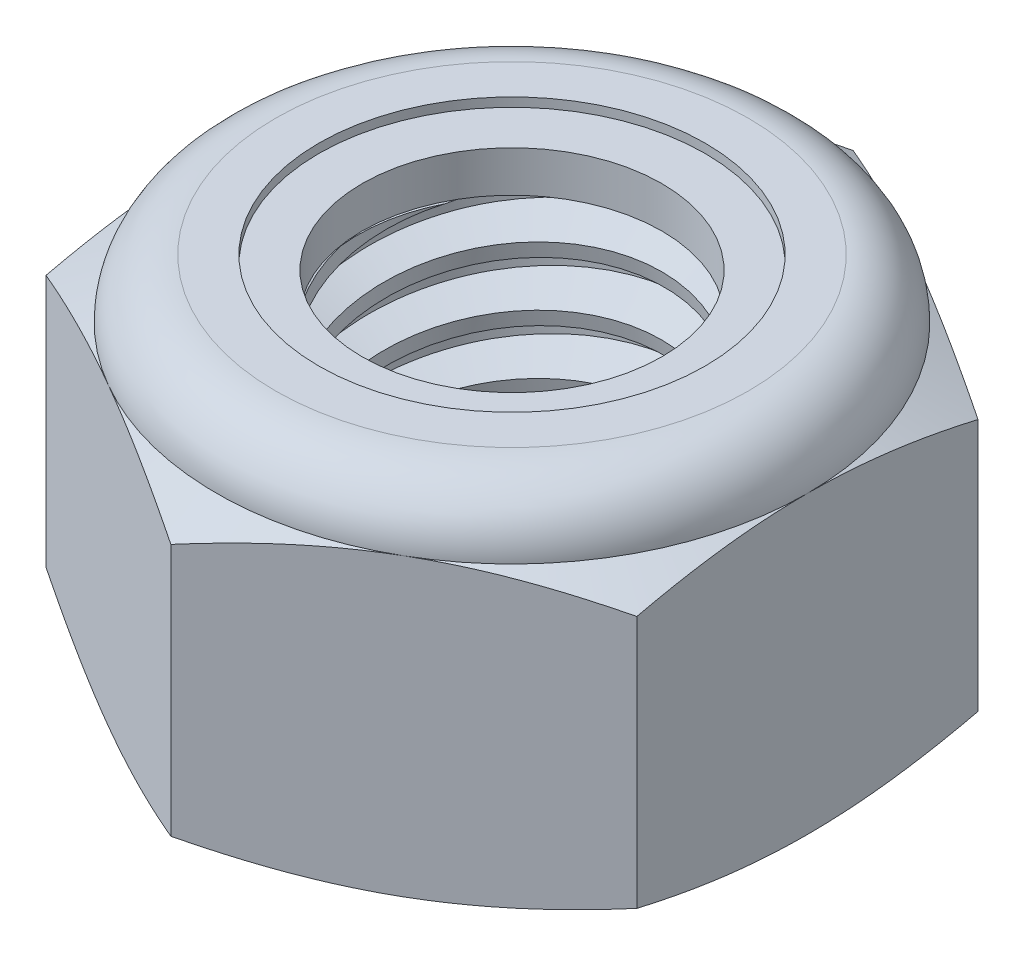
from build123d import *

# Parameters (mm, degrees)
EXTRUDE1_DEPTH      = 6
SKETCH2_W           = 3
SKETCH2_H           = 6
LPATTERN1_COUNT     = 6
LPATTERN1_PITCH     = 1
LPATTERN1_COL_COUNT = 2
LPATTERN1_COL_PITCH = 1


with BuildPart() as part:
    # Sketch1 → Extrude1 (new body)
    with BuildSketch(Plane(origin=(0, 0, 0), x_dir=(1, 0, 0), z_dir=(0, 1, 0))):
        Polygon((0, 5.773502692), (-5, 2.886751346), (-5, -2.886751346), (0, -5.773502692), (5, -2.886751346), (5, 2.886751346), align=None)
    extrude(amount=EXTRUDE1_DEPTH)

    # Sketch4 → Cut-Revolve2 (revolve, cut)
    with BuildSketch(Plane(origin=(0, 0, 0), x_dir=(0, 0, -1), z_dir=(1, 0, 0)), mode=Mode.PRIVATE) as cut_revolve2_sk:
        Polygon((0, 6), (3, 6), (2.538023184, 5.784576673), (2.538023184, 0.215423327), (3, 0), (0, 0), align=None)
    revolve(cut_revolve2_sk.sketch.rotate(Axis((0, 6, 0), (0, 1, 0)), 55.157981045), axis=Axis((0, 6, 0), (0, 1, 0)), mode=Mode.SUBTRACT)


with BuildPart() as body_2:
    # Sketch2 → Revolve1 (revolve)
    with BuildSketch(Plane(origin=(0, 0, 0), x_dir=(0, 0, -1), z_dir=(1, 0, 0))):
        with Locations((1.5, 3)):
            Rectangle(SKETCH2_W, SKETCH2_H)
    revolve(axis=Axis((0, -3, 0), (0, 1, 0)))

    # Sketch3 → Cut-Revolve1 (revolve, cut)
    with BuildSketch(Plane(origin=(0, 0, 0), x_dir=(0, 0, -1), z_dir=(1, 0, 0)), mode=Mode.PRIVATE) as cut_revolve1_sk:
        Polygon((3.020549873, 5.87670076), (3.164398987, 5.013606076), (2.579122931, 5.232870615), (2.538023184, 5.479469096), align=None)
    cut_revolve1 = revolve(cut_revolve1_sk.sketch.rotate(Axis((0, 6, 0.178376498), (0, -0.9863939238321436, -0.1643989873053581)), 180), axis=Axis((0, 6, 0.178376498), (0, -0.9863939238321436, -0.1643989873053581)), mode=Mode.SUBTRACT)

    # LPattern1: Cut-Revolve1 ×6
    with Locations(*[(0, -i * LPATTERN1_PITCH, 0) for i in range(1, LPATTERN1_COUNT)]):
        add(cut_revolve1, mode=Mode.SUBTRACT)

    # LPattern1 col: Cut-Revolve1 ×2
    with Locations(*[(0, i * LPATTERN1_COL_PITCH, 0) for i in range(1, LPATTERN1_COL_COUNT)]):
        add(cut_revolve1, mode=Mode.SUBTRACT)


with BuildPart() as part_1:
    add(part.part)

    # Combine1: cut body 2
    add(body_2.part, mode=Mode.SUBTRACT)

    # Sketch5 → Cut-Revolve3 (revolve, cut)
    with BuildSketch(Plane(origin=(0, 0, 0), x_dir=(0, 0, -1), z_dir=(1, 0, 0)), mode=Mode.PRIVATE) as cut_revolve3_sk:
        with BuildLine():
            Line((0, 0), (5, 0))
            Line((5, 0), (5.773502692, 0.360690229))
            Line((5.773502692, 0.360690229), (5.773502692, 4.639309771))
            Line((5.773502692, 4.639309771), (5, 5))
            ThreePointArc((5, 5), (4.707106781, 5.707106781), (4, 6))
            Line((4, 6), (4, 7.27))
            Line((4, 7.27), (7.043502692, 7.27))
            Line((7.043502692, 7.27), (7.043502692, -1.27))
            Line((7.043502692, -1.27), (0, -1.27))
            Line((0, -1.27), (0, 0))
        make_face()
    revolve(cut_revolve3_sk.sketch.rotate(Axis((0, 0, 0), (0, 1, 0)), 55.157981045), axis=Axis((0, 0, 0), (0, 1, 0)), mode=Mode.SUBTRACT)

    # Sketch6 → Cut-Revolve4 (revolve, cut)
    with BuildSketch(Plane(origin=(0, 0, 0), x_dir=(0, 0, -1), z_dir=(1, 0, 0)), mode=Mode.PRIVATE) as cut_revolve4_sk:
        with BuildLine():
            Line((0, 5), (4.8476, 5))
            ThreePointArc((4.8476, 5), (4.599343708, 5.599343708), (4, 5.8476))
            Line((4, 5.8476), (3.269011592, 5.8476))
            Line((3.269011592, 5.8476), (3.269011592, 7.27))
            Line((3.269011592, 7.27), (0, 7.27))
            Line((0, 7.27), (0, 5))
        make_face()
    revolve(cut_revolve4_sk.sketch.rotate(Axis((0, 7.27, 0), (0, 1, 0)), 32.153394979), axis=Axis((0, 7.27, 0), (0, 1, 0)), mode=Mode.SUBTRACT)


with BuildPart() as body_2_2:
    # Sketch7 → Revolve2 (revolve)
    with BuildSketch(Plane(origin=(0, 0, 0), x_dir=(0, 0, -1), z_dir=(1, 0, 0))):
        with BuildLine():
            Line((2.538023184, 5.0762), (4.767627201, 5.0762))
            ThreePointArc((4.767627201, 5.0762), (4.51782105, 5.57176859), (4, 5.7714))
            Line((4, 5.7714), (2.538023184, 5.7714))
            Line((2.538023184, 5.7714), (2.538023184, 5.0762))
        make_face()
    revolve(axis=Axis((0, 5.0762, 0), (0, 1, 0)))


solid = Compound([part_1.part, body_2_2.part])
